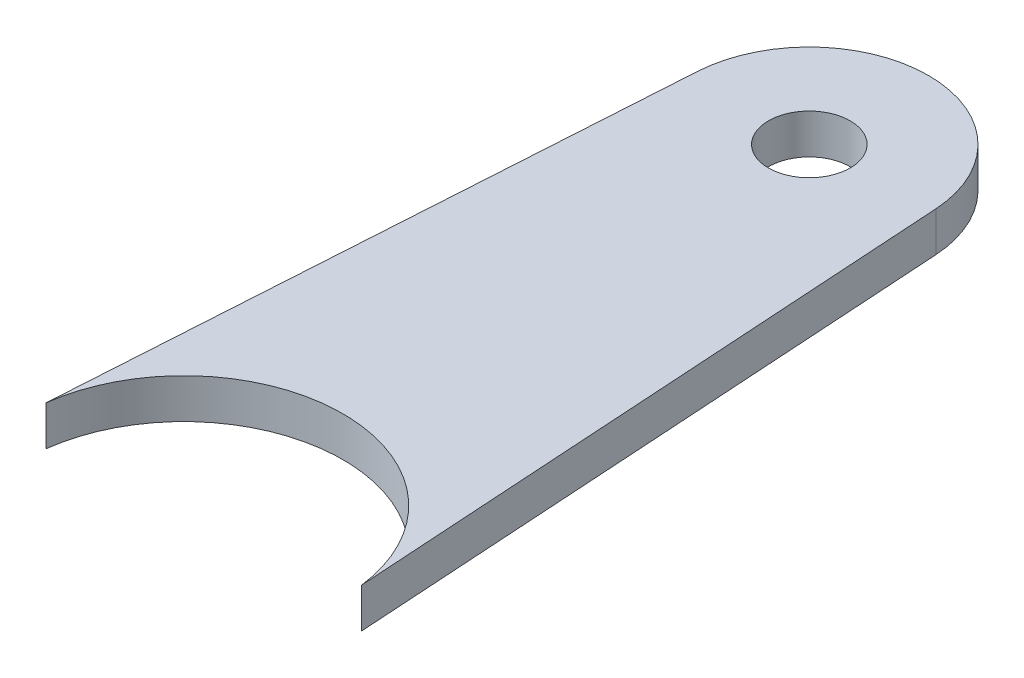
from build123d import *

# Parameters (mm, degrees)
SKETCH1_R           = 3.2639
BOSS_EXTRUDE1_DEPTH = 3.175


with BuildPart() as part:
    # Sketch1 → Boss-Extrude1 (new body)
    with BuildSketch(Plane(origin=(0, 0, 0), x_dir=(1, 0, 0), z_dir=(0, 1, 0))):
        with BuildLine():
            Line((3.19396596, 50.537184344), (0.10105108, 1.598901536))
            ThreePointArc((0.10105108, 1.598901536), (12.7, 12.7), (25.29894892, 1.598901536))
            Line((25.29894892, 1.598901536), (22.20603404, 50.537184344))
            ThreePointArc((22.20603404, 50.537184344), (12.7, 59.4614), (3.19396596, 50.537184344))
        make_face()
        with Locations(Location((12.7, 49.9364, 0), (0, 0, 270))):
            Circle(SKETCH1_R, mode=Mode.SUBTRACT)
    extrude(amount=BOSS_EXTRUDE1_DEPTH)


solid = part.part
